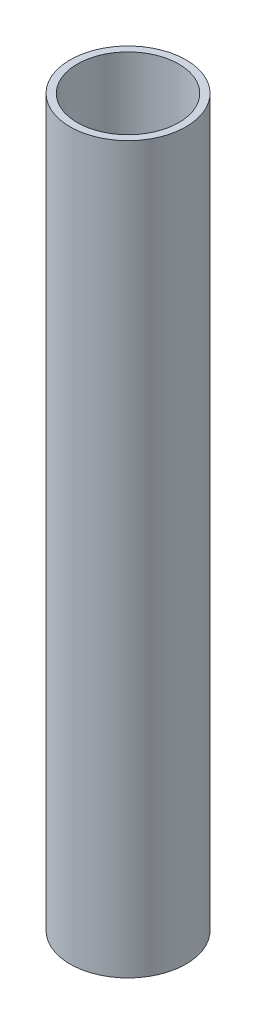
from build123d import *

# Parameters (mm, degrees)
SKETCH1_R           = 7.999988497
SKETCH1_R_2         = 7
BOSS_EXTRUDE1_DEPTH = 100


with BuildPart() as part:
    # Sketch1 → Boss-Extrude1 (new body)
    with BuildSketch(Plane.XZ.offset(17.770243558)):
        with Locations(Location((27.592473816, 175.673262417, 0), (0, 0, 270))):
            Circle(SKETCH1_R)
        with Locations(Location((27.592473816, 175.673262417, 0), (0, 0, 270))):
            Circle(SKETCH1_R_2, mode=Mode.SUBTRACT)
    extrude(amount=BOSS_EXTRUDE1_DEPTH)


solid = part.part
